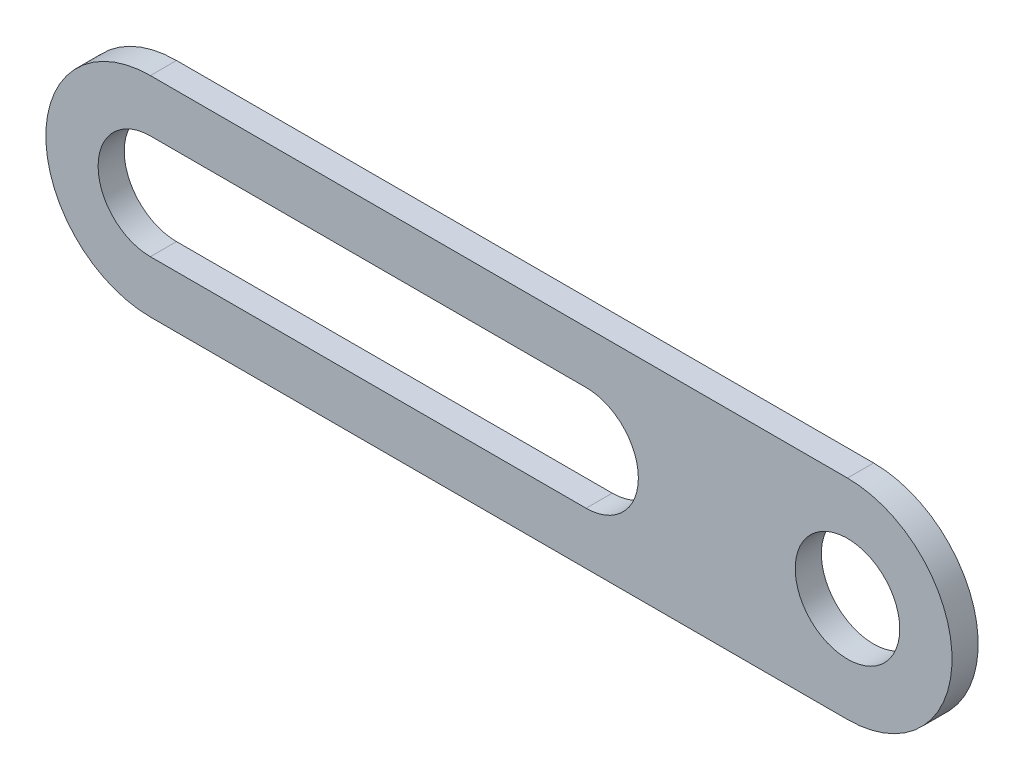
from build123d import *

# Parameters (mm, degrees)
SKETCH1_R           = 6
BOSS_EXTRUDE1_DEPTH = 3


with BuildPart() as part:
    # Sketch1 → Boss-Extrude1 (new body)
    with BuildSketch(Plane.XY):
        with BuildLine():
            Line((-69.375, 9.5625), (10.625, 9.5625))
            ThreePointArc((10.625, 9.5625), (22.625, -2.4375), (10.625, -14.4375))
            Line((10.625, -14.4375), (-69.375, -14.4375))
            ThreePointArc((-69.375, -14.4375), (-81.375, -2.4375), (-69.375, 9.5625))
        make_face()
        with Locations((10.625, -2.4375)):
            Circle(SKETCH1_R, mode=Mode.SUBTRACT)
        with BuildLine():
            Line((-69.375, 3.5625), (-19.375, 3.5625))
            ThreePointArc((-19.375, 3.5625), (-13.375, -2.4375), (-19.375, -8.4375))
            Line((-19.375, -8.4375), (-69.375, -8.4375))
            ThreePointArc((-69.375, -8.4375), (-75.375, -2.4375), (-69.375, 3.5625))
        make_face(mode=Mode.SUBTRACT)
    extrude(amount=BOSS_EXTRUDE1_DEPTH)


solid = part.part
